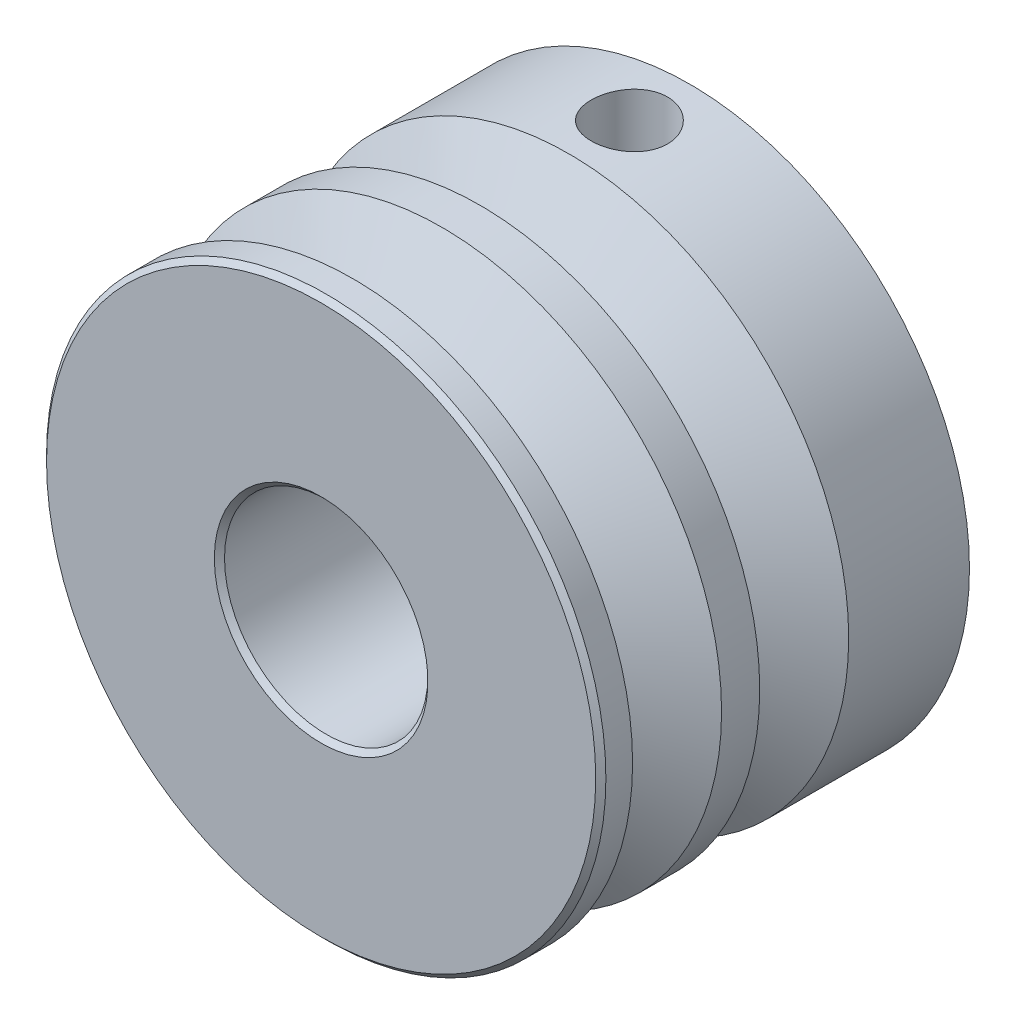
from build123d import *

# Parameters (mm, degrees)
SKETCH_2_W               = 1.5
SKETCH_2_H               = 15.026279442
PATTERN_CIRCULAR_1_COUNT = 2
PATTERN_CIRCULAR_1_ANGLE = 120
CHAMFER_1_SIZE           = 0.2


with BuildPart() as part:
    # 草图1 → 旋转1 (revolve)
    with BuildSketch(Plane(origin=(0, 0, 0), x_dir=(0, 0, -1), z_dir=(1, 0, 0)), mode=Mode.PRIVATE) as revolve_1_sk:
        with BuildLine():
            Line((0, 4), (15, 4))
            Line((15, 4), (15, 5))
            Line((15, 5), (14.5, 5))
            Line((14.5, 5), (14.5, 11))
            Line((14.5, 11), (9.75, 11))
            Line((9.75, 11), (8.08660254, 8.118911087))
            ThreePointArc((8.08660254, 8.118911087), (8, 8.068911087), (7.91339746, 8.118911087))
            Line((7.91339746, 8.118911087), (6.25, 11))
            Line((6.25, 11), (4.75, 11))
            Line((4.75, 11), (3.08660254, 8.118911087))
            ThreePointArc((3.08660254, 8.118911087), (3, 8.068911087), (2.91339746, 8.118911087))
            Line((2.91339746, 8.118911087), (1.25, 11))
            Line((1.25, 11), (0, 11))
            Line((0, 11), (0, 4))
        make_face()
    revolve(revolve_1_sk.sketch.rotate(Axis((0, 0, 0), (0, 0, -1)), 90), axis=Axis((0, 0, 0), (0, 0, -1)))

    # 草图2 → M3 螺纹孔1 (revolve, cut)
    with BuildSketch(Plane(origin=(0, 0, -12.125), x_dir=(0, 0, -1), z_dir=(1, 0, 0))):
        with Locations((0.75, 7.513139721)):
            Rectangle(SKETCH_2_W, SKETCH_2_H)
    hole_wizard_m3_1 = revolve(axis=Axis((0, -6.35, -12.125), (0, 1, 0)), mode=Mode.SUBTRACT)

    # 阵列(圆周)1: M3 螺纹孔1 ×2 about axis
    pattern_circular_1_axis = Axis((0, 0, 0), (0, 0, 1))
    for i in range(1, PATTERN_CIRCULAR_1_COUNT):
        add(hole_wizard_m3_1.rotate(pattern_circular_1_axis, i * PATTERN_CIRCULAR_1_ANGLE / (PATTERN_CIRCULAR_1_COUNT - 1)), mode=Mode.SUBTRACT)

    # 倒角1
    chamfer_1_edges = [part.edges().sort_by_distance(p)[0] for p in [
        (-5, 0, -15),
        (-11, 0, 0),
        (-4, 0, 0),
        (-4, 0, -15),
    ]]
    chamfer(chamfer_1_edges, length=CHAMFER_1_SIZE)


solid = part.part
